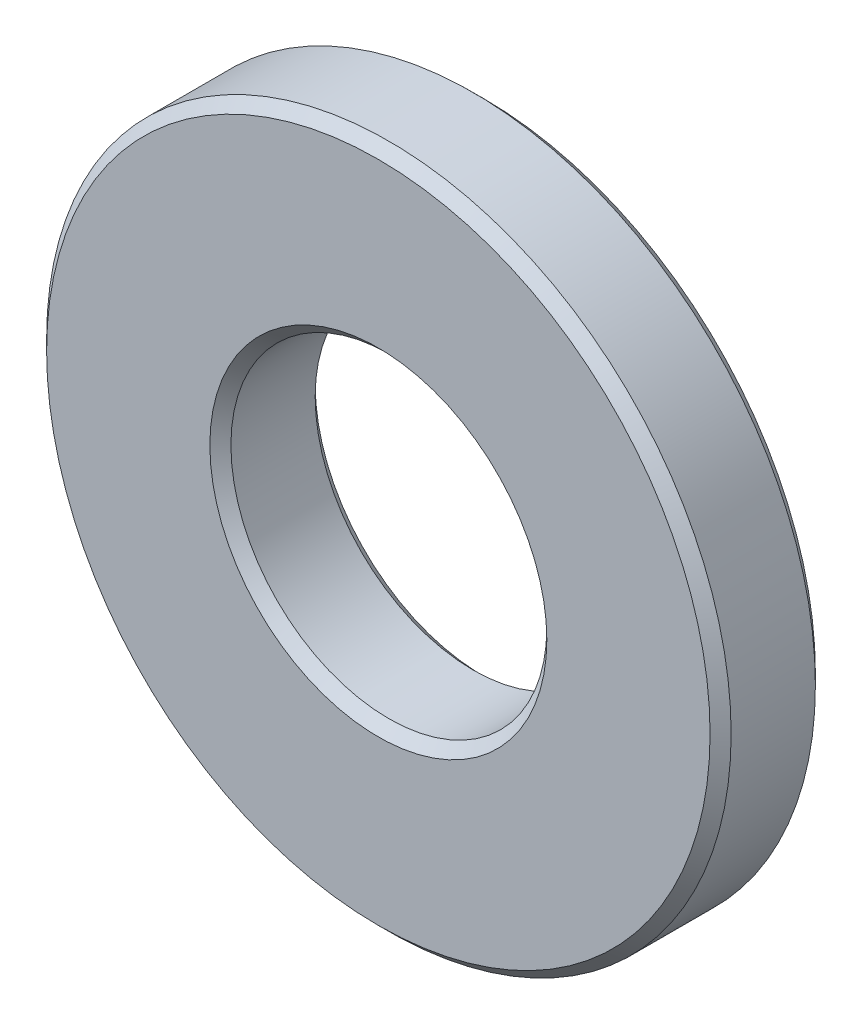
from build123d import *

# Parameters (mm, degrees)
SKETCH1_R      = 32.5
SKETCH1_R_2    = 15
EXTRUDE1_DEPTH = 5
CHAMFER2_SIZE  = 1


with BuildPart() as part:
    # Sketch1 → Extrude1 (new, symmetric)
    with BuildSketch(Plane.XY):
        Circle(SKETCH1_R)
        Circle(SKETCH1_R_2, mode=Mode.SUBTRACT)
    extrude(amount=EXTRUDE1_DEPTH, both=True)

    # Chamfer2
    chamfer2_edges = [part.edges().sort_by_distance(p)[0] for p in [
        (-32.5, 0, -5),
        (-32.5, 0, 5),
        (-15, 0, -5),
        (-15, 0, 5),
    ]]
    chamfer(chamfer2_edges, length=CHAMFER2_SIZE)


solid = part.part
